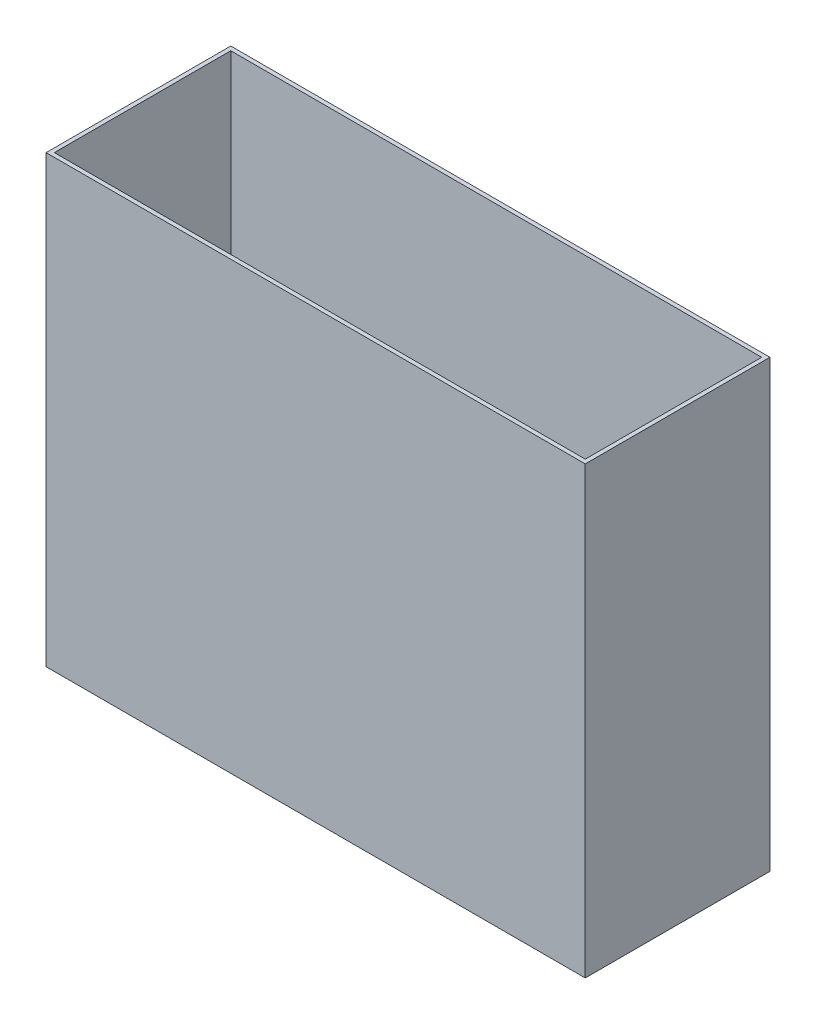
from build123d import *

# Parameters (mm, degrees)
ESBO_O1_W                = 337
ESBO_O1_H                = 112
RESSALTO_EXTRUS_O1_DEPTH = 280
CASCA1_T                 = 2.6


with BuildPart() as part:
    # Esboço1 → Ressalto-extrusão1 (new body)
    with BuildSketch(Plane(origin=(0, 0, 0), x_dir=(1, 0, 0), z_dir=(0, 1, 0))):
        with Locations((168.5, 56)):
            Rectangle(ESBO_O1_W, ESBO_O1_H)
    extrude(amount=RESSALTO_EXTRUS_O1_DEPTH)

    # Casca1
    casca1_openings = [part.faces().sort_by_distance(p)[0] for p in [
        (168.5, 280, -56),
    ]]
    offset(amount=CASCA1_T, openings=casca1_openings, kind=Kind.INTERSECTION)


solid = part.part
